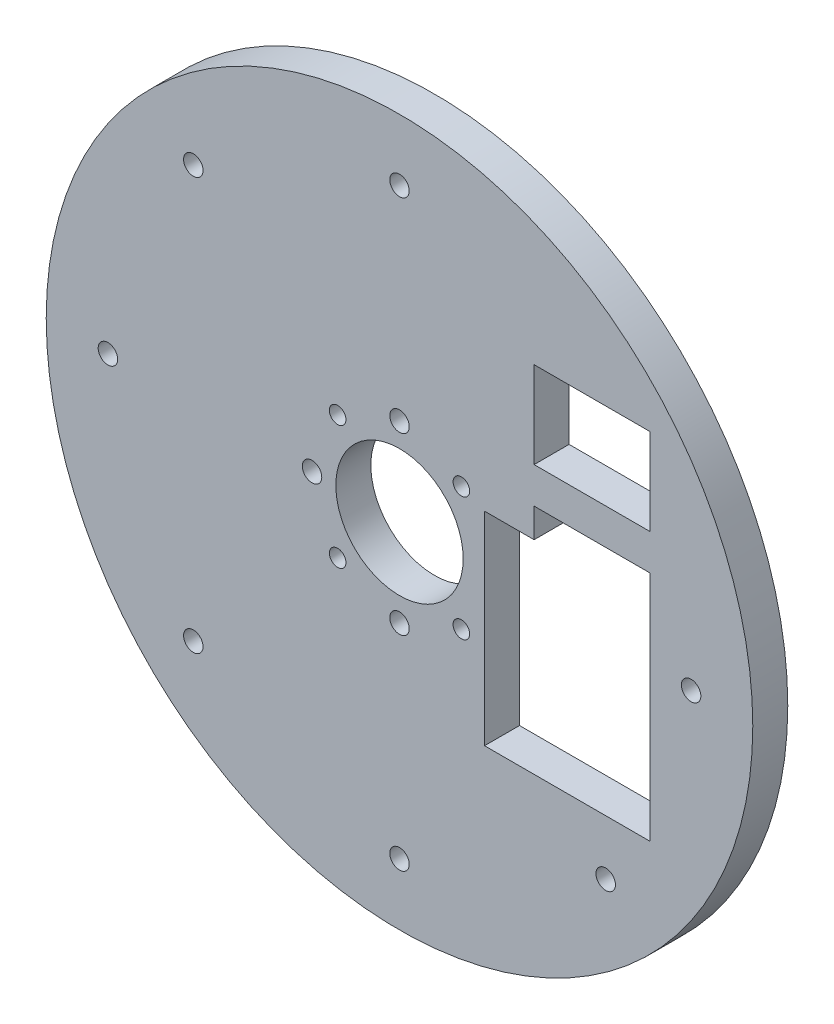
from build123d import *

# Parameters (mm, degrees)
SKETCH1_R           = 60.5
SKETCH1_R_2         = 11
SKETCH1_R_3         = 1.75
SKETCH1_R_4         = 1.5
BOSS_EXTRUDE1_DEPTH = 6
SKETCH2_W           = 20
SKETCH2_H           = 15
CUT_EXTRUDE1_DEPTH  = 86.77004139
MOVE_FACE1_BY       = 0.08
MOVE_FACE1_2_BY     = 0.08
MOVE_FACE1_3_BY     = 0.08
MOVE_FACE1_4_BY     = 0.08
MOVE_FACE1_5_BY     = 0.08
MOVE_FACE1_6_BY     = 0.08
MOVE_FACE1_7_BY     = 0.08
MOVE_FACE1_8_BY     = 0.08
MOVE_FACE1_9_BY     = 0.08
MOVE_FACE1_10_BY    = 0.08
MOVE_FACE1_11_BY    = 0.08
MOVE_FACE1_12_BY    = 0.08
MOVE_FACE1_13_BY    = 0.08
MOVE_FACE1_14_BY    = 0.08
MOVE_FACE1_15_BY    = 0.08
MOVE_FACE1_16_BY    = 0.08
MOVE_FACE1_17_BY    = 0.08
MOVE_FACE1_18_BY    = 0.08
MOVE_FACE1_19_BY    = 0.08
MOVE_FACE1_20_BY    = 0.08
MOVE_FACE1_21_BY    = 0.08
MOVE_FACE1_22_BY    = 0.08
MOVE_FACE1_23_BY    = 0.08
MOVE_FACE1_24_BY    = 0.08
MOVE_FACE1_25_BY    = 0.08
MOVE_FACE1_26_BY    = 0.08


with BuildPart() as part:
    # Sketch1 → Boss-Extrude1 (new body)
    with BuildSketch(Plane.XY):
        Circle(SKETCH1_R)
        Circle(SKETCH1_R_2, mode=Mode.SUBTRACT)
        with Locations((0, -15)):
            Circle(SKETCH1_R_3, mode=Mode.SUBTRACT)
        with Locations((10.606601718, -10.606601718)):
            Circle(SKETCH1_R_4, mode=Mode.SUBTRACT)
        with Locations((0, -50)):
            Circle(SKETCH1_R_3, mode=Mode.SUBTRACT)
        with Locations((-15, 0)):
            Circle(SKETCH1_R_3, mode=Mode.SUBTRACT)
        with Locations((-10.606601718, -10.606601718)):
            Circle(SKETCH1_R_4, mode=Mode.SUBTRACT)
        with Locations((0, 15)):
            Circle(SKETCH1_R_3, mode=Mode.SUBTRACT)
        with Locations((-10.606601718, 10.606601718)):
            Circle(SKETCH1_R_4, mode=Mode.SUBTRACT)
        with Locations((10.606601718, 10.606601718)):
            Circle(SKETCH1_R_4, mode=Mode.SUBTRACT)
        with Locations((-35.355339059, -35.355339059)):
            Circle(SKETCH1_R_3, mode=Mode.SUBTRACT)
        with Locations((-50, 0)):
            Circle(SKETCH1_R_3, mode=Mode.SUBTRACT)
        with Locations((-35.355339059, 35.355339059)):
            Circle(SKETCH1_R_3, mode=Mode.SUBTRACT)
        with Locations((0, 50)):
            Circle(SKETCH1_R_3, mode=Mode.SUBTRACT)
        with Locations((50, 0)):
            Circle(SKETCH1_R_3, mode=Mode.SUBTRACT)
        with Locations((35.355339059, -35.355339059)):
            Circle(SKETCH1_R_3, mode=Mode.SUBTRACT)
    extrude(amount=BOSS_EXTRUDE1_DEPTH)

    # Sketch2 → Cut-Extrude1 (cut, through all)
    with BuildSketch(Plane.XY.offset(6)):
        Polygon((23, 14), (43, 14), (43, -26), (14.5, -26), (14.5, 9), (23, 9), align=None)
        with Locations((33, 27.5)):
            Rectangle(SKETCH2_W, SKETCH2_H)
    extrude(amount=-CUT_EXTRUDE1_DEPTH, mode=Mode.SUBTRACT)

    # Move Face1: a face moved outward by 0.08
    extrude(part.faces().sort_by_distance((23, 27.5, 3))[0], amount=MOVE_FACE1_BY, dir=(1, 0, 0))

    # Move Face1 2: a curved face moved outward by 0.08
    add(Solid.thicken(part.faces().sort_by_distance((-11, 0, 3))[0], MOVE_FACE1_2_BY))

    # Move Face1 3: a curved face moved outward by 0.08
    add(Solid.thicken(part.faces().sort_by_distance((-60.5, 0, 3))[0], MOVE_FACE1_3_BY))

    # Move Face1 4: a curved face moved outward by 0.08
    add(Solid.thicken(part.faces().sort_by_distance((-1.75, -15, 3))[0], MOVE_FACE1_4_BY))

    # Move Face1 5: a curved face moved outward by 0.08
    add(Solid.thicken(part.faces().sort_by_distance((9.106601718, -10.606601718, 3))[0], MOVE_FACE1_5_BY))

    # Move Face1 6: a curved face moved outward by 0.08
    add(Solid.thicken(part.faces().sort_by_distance((-1.75, -50, 3))[0], MOVE_FACE1_6_BY))

    # Move Face1 7: a curved face moved outward by 0.08
    add(Solid.thicken(part.faces().sort_by_distance((-16.75, 0, 3))[0], MOVE_FACE1_7_BY))

    # Move Face1 8: a curved face moved outward by 0.08
    add(Solid.thicken(part.faces().sort_by_distance((-12.106601718, -10.606601718, 3))[0], MOVE_FACE1_8_BY))

    # Move Face1 9: a curved face moved outward by 0.08
    add(Solid.thicken(part.faces().sort_by_distance((-1.75, 15, 3))[0], MOVE_FACE1_9_BY))

    # Move Face1 10: a curved face moved outward by 0.08
    add(Solid.thicken(part.faces().sort_by_distance((-12.106601718, 10.606601718, 3))[0], MOVE_FACE1_10_BY))

    # Move Face1 11: a curved face moved outward by 0.08
    add(Solid.thicken(part.faces().sort_by_distance((9.106601718, 10.606601718, 3))[0], MOVE_FACE1_11_BY))

    # Move Face1 12: a curved face moved outward by 0.08
    add(Solid.thicken(part.faces().sort_by_distance((-37.105339059, -35.355339059, 3))[0], MOVE_FACE1_12_BY))

    # Move Face1 13: a curved face moved outward by 0.08
    add(Solid.thicken(part.faces().sort_by_distance((-51.75, 0, 3))[0], MOVE_FACE1_13_BY))

    # Move Face1 14: a curved face moved outward by 0.08
    add(Solid.thicken(part.faces().sort_by_distance((-37.105339059, 35.355339059, 3))[0], MOVE_FACE1_14_BY))

    # Move Face1 15: a curved face moved outward by 0.08
    add(Solid.thicken(part.faces().sort_by_distance((-1.75, 50, 3))[0], MOVE_FACE1_15_BY))

    # Move Face1 16: a curved face moved outward by 0.08
    add(Solid.thicken(part.faces().sort_by_distance((48.25, 0, 3))[0], MOVE_FACE1_16_BY))

    # Move Face1 17: a curved face moved outward by 0.08
    add(Solid.thicken(part.faces().sort_by_distance((33.605339059, -35.355339059, 3))[0], MOVE_FACE1_17_BY))

    # Move Face1 18: a face moved outward by 0.08
    extrude(part.faces().sort_by_distance((18.75, 9, 3))[0], amount=MOVE_FACE1_18_BY, dir=(0, -1, 0))

    # Move Face1 19: a face moved outward by 0.08
    extrude(part.faces().sort_by_distance((14.5, -8.5, 3))[0], amount=MOVE_FACE1_19_BY, dir=(1, 0, 0))

    # Move Face1 20: a face moved outward by 0.08
    extrude(part.faces().sort_by_distance((28.75, -26, 3))[0], amount=MOVE_FACE1_20_BY, dir=(0, 1, 0))

    # Move Face1 21: a face moved outward by 0.08
    extrude(part.faces().sort_by_distance((43, -6, 3))[0], amount=MOVE_FACE1_21_BY, dir=(-1, 0, 0))

    # Move Face1 22: a face moved outward by 0.08
    extrude(part.faces().sort_by_distance((33, 14, 3))[0], amount=MOVE_FACE1_22_BY, dir=(0, -1, 0))

    # Move Face1 23: a face moved outward by 0.08
    extrude(part.faces().sort_by_distance((23, 11.5, 3))[0], amount=MOVE_FACE1_23_BY, dir=(1, 0, 0))

    # Move Face1 24: a face moved outward by 0.08
    extrude(part.faces().sort_by_distance((33, 20, 3))[0], amount=MOVE_FACE1_24_BY, dir=(0, 1, 0))

    # Move Face1 25: a face moved outward by 0.08
    extrude(part.faces().sort_by_distance((43, 27.5, 3))[0], amount=MOVE_FACE1_25_BY, dir=(-1, 0, 0))

    # Move Face1 26: a face moved outward by 0.08
    extrude(part.faces().sort_by_distance((33, 35, 3))[0], amount=MOVE_FACE1_26_BY, dir=(0, -1, 0))


solid = part.part
